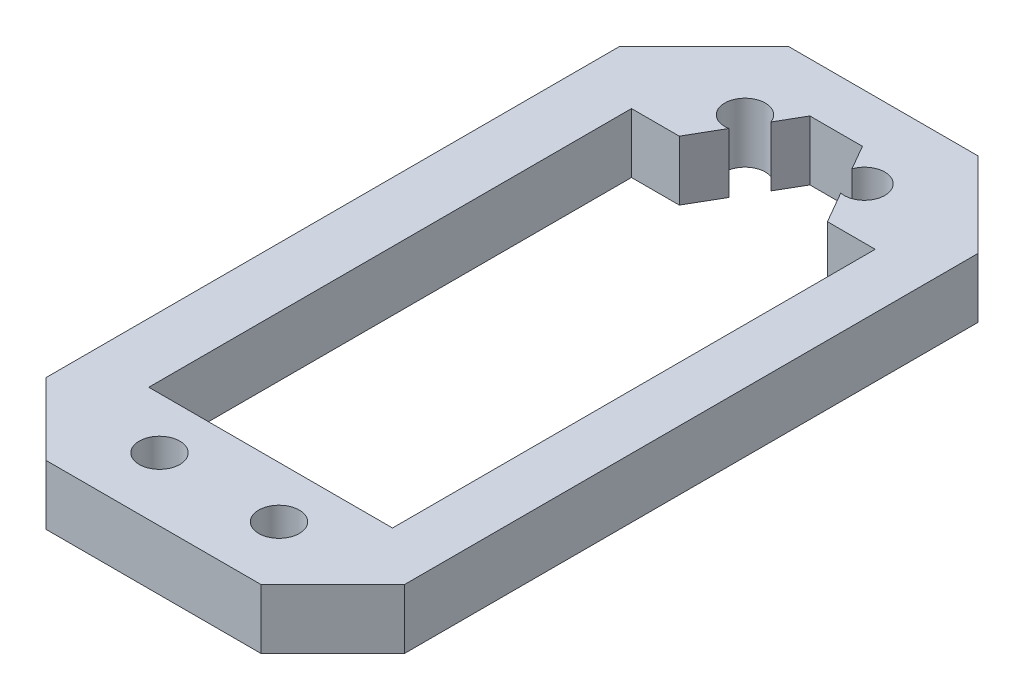
from build123d import *

# Parameters (mm, degrees)
SKETCH_1_R      = 1.7
EXTRUDE_1_DEPTH = 5


with BuildPart() as part:
    # 草图1 → 凸台-拉伸1 (new body)
    with BuildSketch(Plane(origin=(0, 0, 0), x_dir=(1, 0, 0), z_dir=(0, 1, 0))):
        Polygon((1439.011595349, 1417.863209963), (1439.011595349, 1369.863209963), (1433.011595349, 1363.863209963), (1415.011595349, 1363.863209963), (1409.011595349, 1369.863209963), (1409.011595349, 1417.863209963), (1416.08266316, 1424.934277775), (1431.940527537, 1424.934277775), align=None)
        with Locations(Location((1429.211595349, 1369.163209963, 0), (0, 0, 270))):
            Circle(SKETCH_1_R, mode=Mode.SUBTRACT)
        with Locations(Location((1419.211595349, 1369.163209963, 0), (0, 0, 270))):
            Circle(SKETCH_1_R, mode=Mode.SUBTRACT)
        with BuildLine():
            Line((1434.411595349, 1413.863209963), (1434.411595349, 1373.463209963))
            Line((1434.411595349, 1373.463209963), (1414.011595349, 1373.463209963))
            Line((1414.011595349, 1373.463209963), (1414.011595349, 1413.863209963))
            Line((1414.011595349, 1413.863209963), (1418.011595349, 1413.863209963))
            Line((1418.011595349, 1413.863209963), (1419.530084528, 1416.493310372))
            ThreePointArc((1419.530084528, 1416.493310372), (1417.739352162, 1419.013209963), (1420.817015405, 1418.722340038))
            Line((1420.817015405, 1418.722340038), (1422.011595349, 1420.791413193))
            Line((1422.011595349, 1420.791413193), (1426.411595349, 1420.791413193))
            Line((1426.411595349, 1420.791413193), (1427.606175292, 1418.722340038))
            ThreePointArc((1427.606175292, 1418.722340038), (1430.683838535, 1419.013209963), (1428.893106169, 1416.493310372))
            Line((1428.893106169, 1416.493310372), (1430.411595349, 1413.863209963))
            Line((1430.411595349, 1413.863209963), (1434.411595349, 1413.863209963))
        make_face(mode=Mode.SUBTRACT)
    extrude(amount=EXTRUDE_1_DEPTH)


solid = part.part
